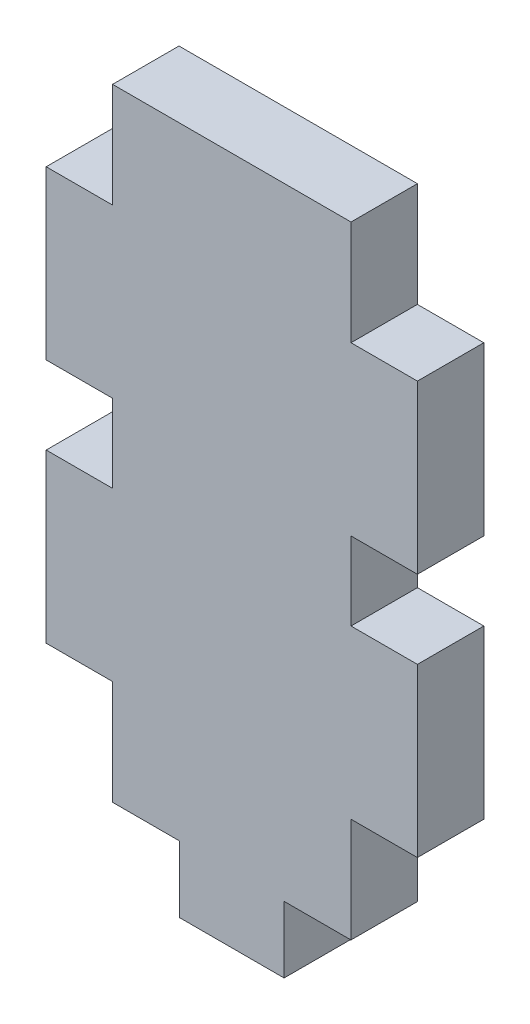
from build123d import *

# Parameters (mm, degrees)
BOSS_EXTRUDE1_DEPTH = 3.175


with BuildPart() as part:
    # Sketch1 → Boss-Extrude1 (new body)
    with BuildSketch(Plane.XY):
        Polygon((-5.7, -14.865), (-2.5, -14.865), (-2.5, -18.04), (2.5, -18.04), (2.5, -14.865), (5.7, -14.865), (5.7, -9.865), (8.875, -9.865), (8.875, -1.865), (5.7, -1.865), (5.7, 1.865), (8.875, 1.865), (8.875, 9.865), (5.7, 9.865), (5.7, 14.865), (-5.7, 14.865), (-5.7, 9.865), (-8.875, 9.865), (-8.875, 1.865), (-5.7, 1.865), (-5.7, -1.865), (-8.875, -1.865), (-8.875, -9.865), (-5.7, -9.865), align=None)
    extrude(amount=BOSS_EXTRUDE1_DEPTH)


solid = part.part
